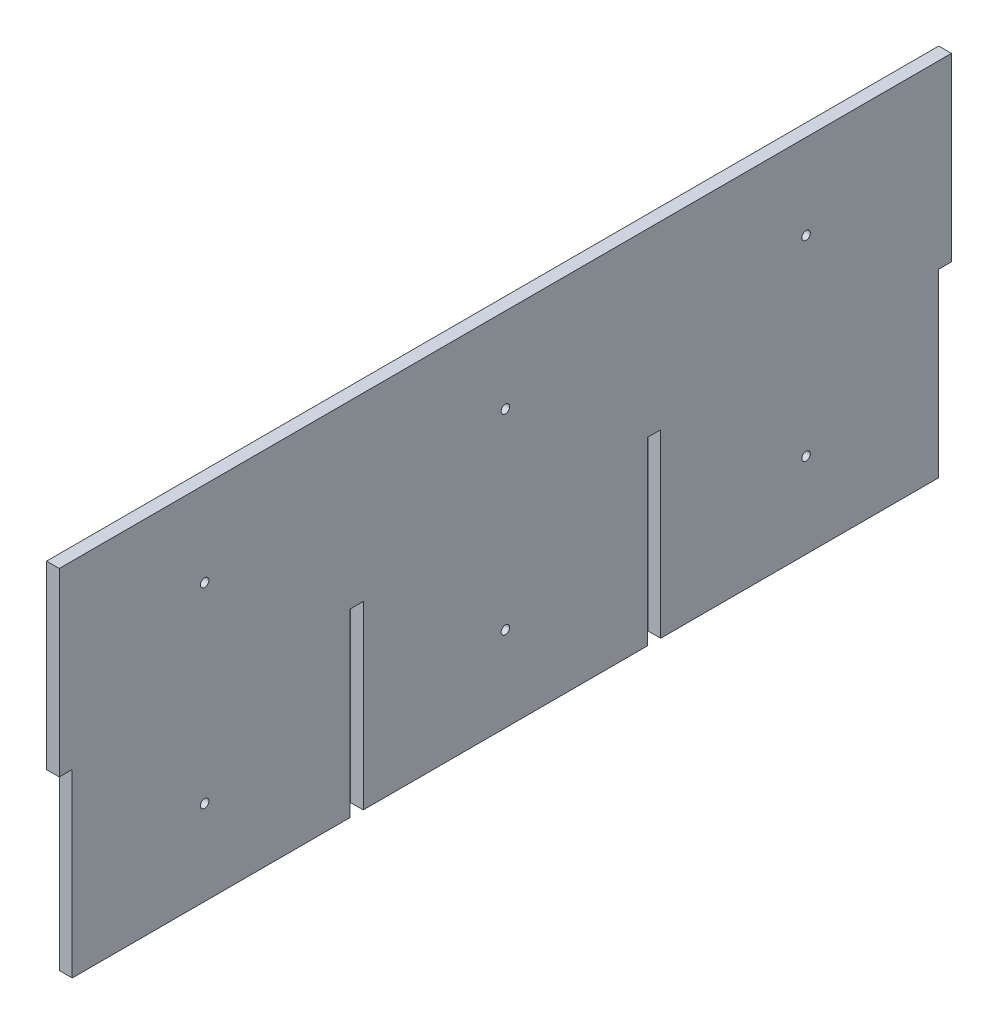
from build123d import *

# Parameters (mm, degrees)
SKETCH3_W           = 420
SKETCH3_H           = 170
BOSS_EXTRUDE2_DEPTH = 6
SKETCH4_W           = 6.1
SKETCH4_H           = 85
SKETCH4_W_2         = 6.2
CUT_EXTRUDE1_DEPTH  = 6
SKETCH5_R           = 2
CUT_EXTRUDE2_DEPTH  = 6
SKETCH6_W           = 6
SKETCH6_H           = 380
BOSS_EXTRUDE3_DEPTH = 30
SKETCH7_W           = 6
SKETCH7_H           = 380
CUT_EXTRUDE3_DEPTH  = 2
SKETCH8_W           = 6
SKETCH8_H           = 116.9
SKETCH8_H_2         = 133.8
BOSS_EXTRUDE4_DEPTH = 28
SKETCH9_W           = 6
SKETCH9_H           = 6.2
BOSS_EXTRUDE5_DEPTH = 113
SKETCH10_W          = 6
SKETCH10_H          = 6.2
BOSS_EXTRUDE6_DEPTH = 113
SKETCH11_W          = 6.2
SKETCH11_H          = 113
CUT_EXTRUDE4_DEPTH  = 113
SKETCH13_W          = 6
SKETCH13_H          = 28
CUT_EXTRUDE5_DEPTH  = 1000


with BuildPart() as part:
    # Sketch3 → Boss-Extrude2 (new body)
    with BuildSketch(Plane(origin=(0, 0, 0), x_dir=(0, 0, -1), z_dir=(1, 0, 0))):
        with Locations((440.911700258, 161.915861829)):
            Rectangle(SKETCH3_W, SKETCH3_H)
    extrude(amount=BOSS_EXTRUDE2_DEPTH)

    # Sketch4 → Cut-Extrude1 (cut)
    with BuildSketch(Plane(origin=(6, 0, 0), x_dir=(0, 0, -1), z_dir=(1, 0, 0))):
        with Locations((233.961700258, 119.415861829)):
            Rectangle(SKETCH4_W, SKETCH4_H)
        with Locations((647.861700258, 119.415861829)):
            Rectangle(SKETCH4_W, SKETCH4_H)
        with Locations((370.911700258, 204.415861829)):
            Rectangle(SKETCH4_W_2, SKETCH4_H)
        with Locations((510.911700258, 204.415861829)):
            Rectangle(SKETCH4_W_2, SKETCH4_H)
    extrude(amount=-CUT_EXTRUDE1_DEPTH, mode=Mode.SUBTRACT)

    # Sketch5 → Cut-Extrude2 (cut)
    with BuildSketch(Plane(origin=(6, 0, 0), x_dir=(0, 0, -1), z_dir=(1, 0, 0))):
        with Locations((299.361700258, 206.915861829)):
            Circle(SKETCH5_R)
        with Locations((299.361700258, 116.915861829)):
            Circle(SKETCH5_R)
        with Locations((440.911700258, 206.915861829)):
            Circle(SKETCH5_R)
        with Locations((582.461700258, 206.915861829)):
            Circle(SKETCH5_R)
        with Locations((582.461700258, 116.915861829)):
            Circle(SKETCH5_R)
        with Locations((440.911700258, 116.915861829)):
            Circle(SKETCH5_R)
    extrude(amount=-CUT_EXTRUDE2_DEPTH, mode=Mode.SUBTRACT)

    # Sketch6 → Boss-Extrude3 (add)
    with BuildSketch(Plane.XZ.offset(-76.915861829)):
        with Locations((3, -440.911700258)):
            Rectangle(SKETCH6_W, SKETCH6_H)
    extrude(amount=BOSS_EXTRUDE3_DEPTH)

    # Sketch7 → Cut-Extrude3 (cut)
    with BuildSketch(Plane.XZ.offset(-46.915861829)):
        with Locations((3, -440.911700258)):
            Rectangle(SKETCH7_W, SKETCH7_H)
    extrude(amount=-CUT_EXTRUDE3_DEPTH, mode=Mode.SUBTRACT)

    # Sketch8 → Boss-Extrude4 (add)
    with BuildSketch(Plane(origin=(0, 246.915861829, 0), x_dir=(1, 0, 0), z_dir=(0, 1, 0))):
        with Locations((3, 309.361700258)):
            Rectangle(SKETCH8_W, SKETCH8_H)
        with Locations((3, 572.461700258)):
            Rectangle(SKETCH8_W, SKETCH8_H)
        with Locations((3, 440.911700258)):
            Rectangle(SKETCH8_W, SKETCH8_H_2)
    extrude(amount=BOSS_EXTRUDE4_DEPTH)

    # Sketch9 → Boss-Extrude5 (add)
    with BuildSketch(Plane(origin=(0, 161.915861829, 0), x_dir=(1, 0, 0), z_dir=(0, 1, 0))):
        with Locations((3, 370.911700258)):
            Rectangle(SKETCH9_W, SKETCH9_H)
    extrude(amount=BOSS_EXTRUDE5_DEPTH)

    # Sketch10 → Boss-Extrude6 (add)
    with BuildSketch(Plane(origin=(0, 161.915861829, 0), x_dir=(1, 0, 0), z_dir=(0, 1, 0))):
        with Locations((3, 510.911700258)):
            Rectangle(SKETCH10_W, SKETCH10_H)
    extrude(amount=BOSS_EXTRUDE6_DEPTH)

    # Sketch11 → Cut-Extrude4 (cut)
    with BuildSketch(Plane(origin=(6, 0, 0), x_dir=(0, 0, -1), z_dir=(1, 0, 0))):
        with Locations((370.911700258, 105.415861829)):
            Rectangle(SKETCH11_W, SKETCH11_H)
        with Locations((510.911700258, 105.415861829)):
            Rectangle(SKETCH11_W, SKETCH11_H)
    extrude(amount=-CUT_EXTRUDE4_DEPTH, mode=Mode.SUBTRACT)

    # Sketch13 → Cut-Extrude5 (cut)
    with BuildSketch(Plane.XY.offset(-250.911700258)):
        with Locations((3, 260.915861829)):
            Rectangle(SKETCH13_W, SKETCH13_H)
        with Locations((3, 62.915861829)):
            Rectangle(SKETCH13_W, SKETCH13_H)
    extrude(amount=-CUT_EXTRUDE5_DEPTH, mode=Mode.SUBTRACT)


solid = part.part
